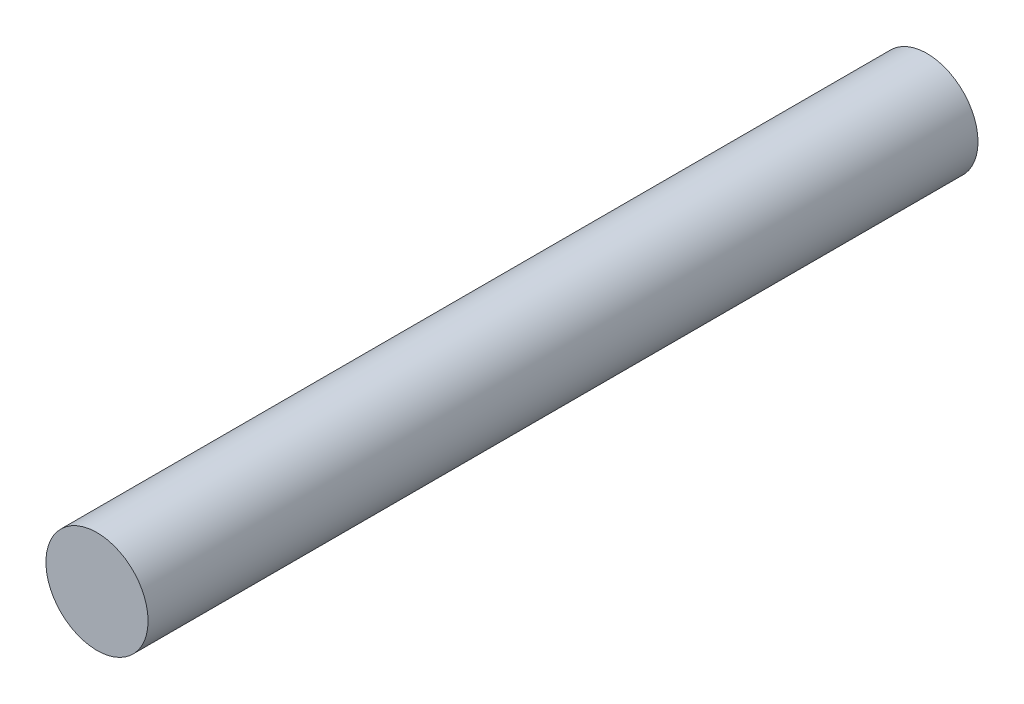
from build123d import *

# Parameters (mm, degrees)
SKETCH1_R           = 4
BOSS_EXTRUDE1_DEPTH = 32.5


with BuildPart() as part:
    # Sketch1 → Boss-Extrude1 (new, symmetric)
    with BuildSketch(Plane.XY):
        Circle(SKETCH1_R)
    extrude(amount=BOSS_EXTRUDE1_DEPTH, both=True)


solid = part.part
